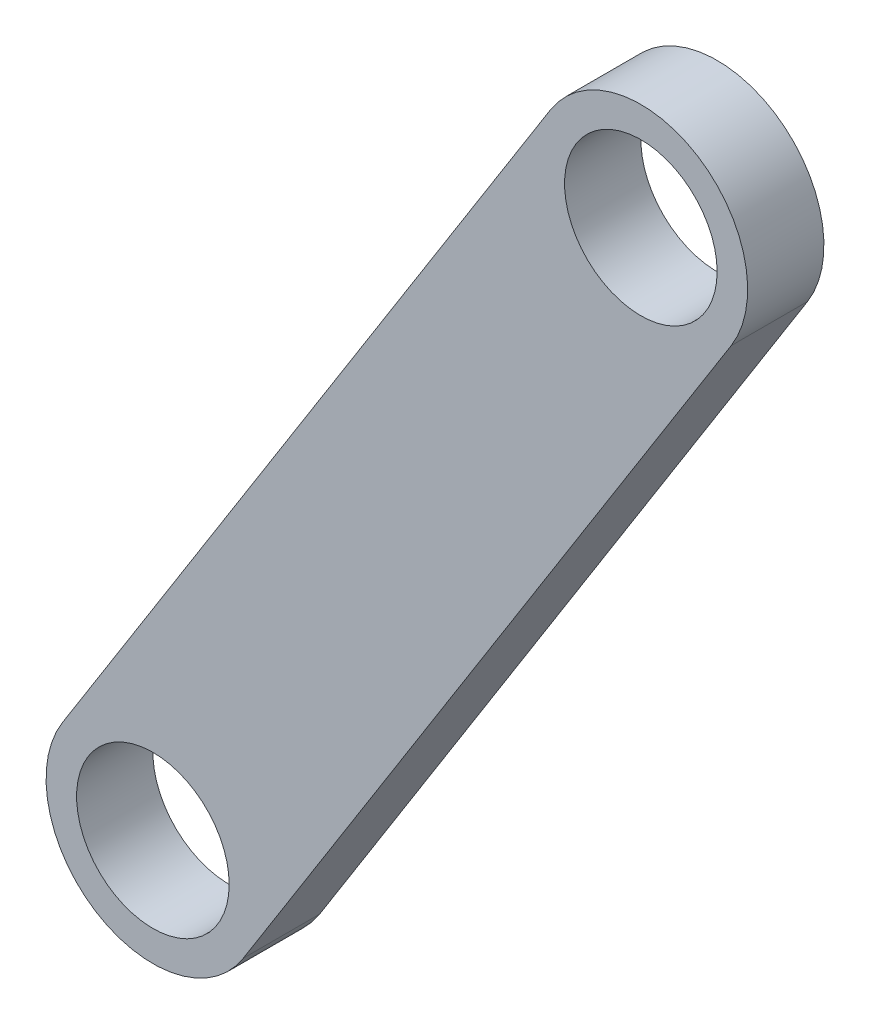
from build123d import *

# Parameters (mm, degrees)
SKETCH1_R           = 5
BOSS_EXTRUDE1_DEPTH = 5


with BuildPart() as part:
    # Sketch1 → Boss-Extrude1 (new body)
    with BuildSketch(Plane.XY):
        with BuildLine():
            Line((-5.92269134, 15.731183096), (26.058878055, 66.497108864))
            ThreePointArc((26.058878055, 66.497108864), (35.712752491, 68.688617107), (37.904260734, 59.034742672))
            Line((37.904260734, 59.034742672), (5.92269134, 8.268816904))
            ThreePointArc((5.92269134, 8.268816904), (-3.731183096, 6.07730866), (-5.92269134, 15.731183096))
        make_face()
        with Locations((0, 12)):
            Circle(SKETCH1_R, mode=Mode.SUBTRACT)
        with Locations((31.981569395, 62.765925768)):
            Circle(SKETCH1_R, mode=Mode.SUBTRACT)
    extrude(amount=BOSS_EXTRUDE1_DEPTH)


solid = part.part
